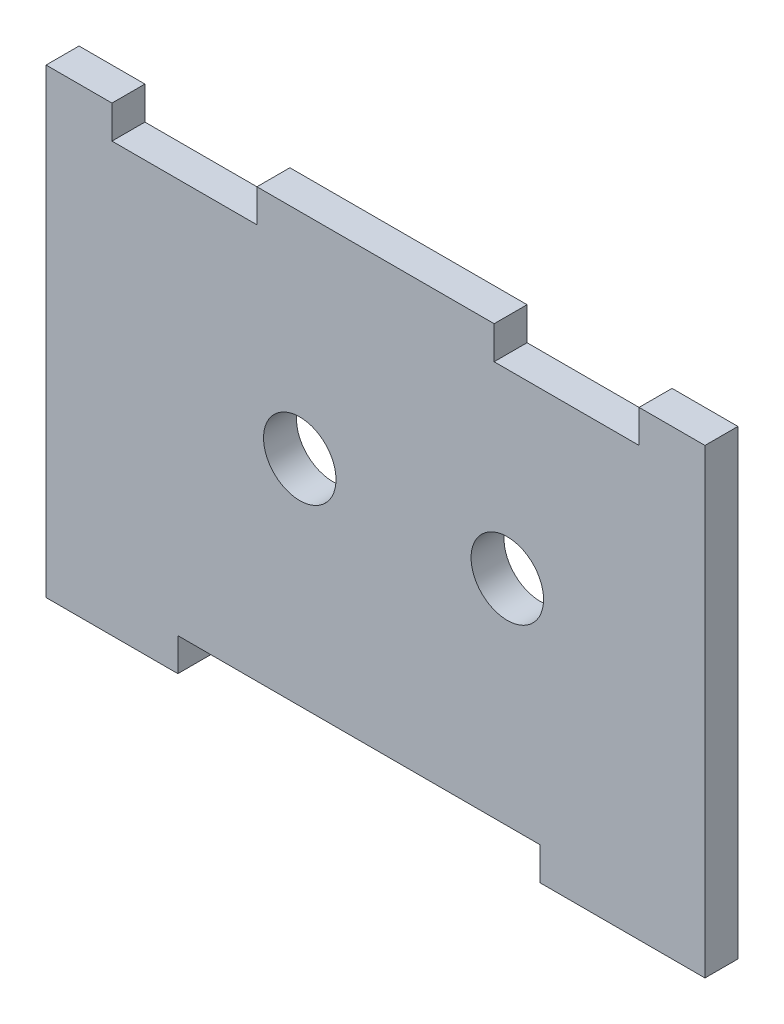
from build123d import *

# Parameters (mm, degrees)
SKETCH1_W           = 127
SKETCH1_H           = 82.55
SKETCH1_R           = 6.985
BOSS_EXTRUDE1_DEPTH = 6.35
SKETCH2_W           = 31.75
SKETCH2_H           = 6.35
SKETCH2_W_2         = 25.4
BOSS_EXTRUDE2_DEPTH = 6.35
SKETCH3_W           = 27.94
SKETCH3_H           = 6.35
CUT_EXTRUDE1_DEPTH  = 6.35


with BuildPart() as part:
    # Sketch1 → Boss-Extrude1 (new body)
    with BuildSketch(Plane.XY):
        with Locations((-63.5, 41.275)):
            Rectangle(SKETCH1_W, SKETCH1_H)
        with Locations((-38.1, 41.275)):
            Circle(SKETCH1_R, mode=Mode.SUBTRACT)
        with Locations((-78.105, 41.275)):
            Circle(SKETCH1_R, mode=Mode.SUBTRACT)
    extrude(amount=BOSS_EXTRUDE1_DEPTH)

    # Sketch2 → Boss-Extrude2 (add)
    with BuildSketch(Plane(origin=(0, 0, 0), x_dir=(-1, 0, 0), z_dir=(0, 0, -1))):
        with Locations((15.875, -3.175)):
            Rectangle(SKETCH2_W, SKETCH2_H)
        with Locations((114.3, -3.175)):
            Rectangle(SKETCH2_W_2, SKETCH2_H)
    extrude(amount=-BOSS_EXTRUDE2_DEPTH)

    # Sketch3 → Cut-Extrude1 (cut)
    with BuildSketch(Plane(origin=(0, 0, 0), x_dir=(-1, 0, 0), z_dir=(0, 0, -1))):
        with Locations((26.67, 79.375)):
            Rectangle(SKETCH3_W, SKETCH3_H)
        with Locations((100.33, 79.375)):
            Rectangle(SKETCH3_W, SKETCH3_H)
    extrude(amount=-CUT_EXTRUDE1_DEPTH, mode=Mode.SUBTRACT)


solid = part.part
